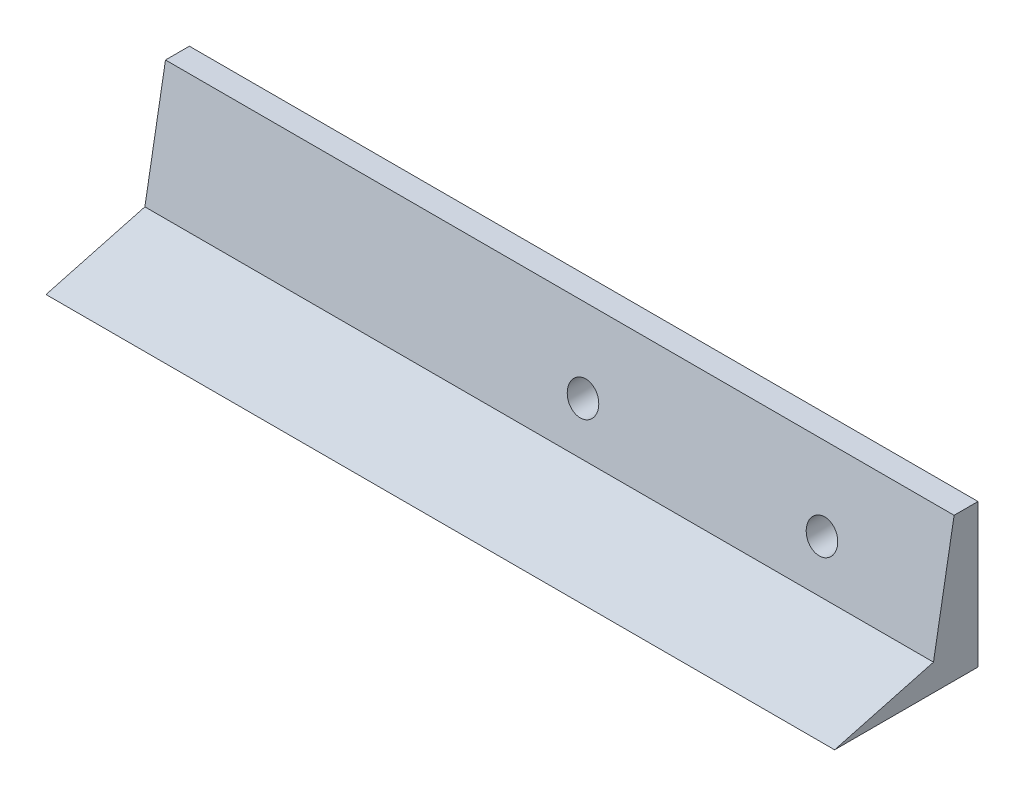
from build123d import *

# Parameters (mm, degrees)
BOSS_EXTRUDE1_DEPTH  = 100
M3_CLEARANCE_HOLE1_D = 3.4
SKETCH4_R            = 3.25
CUT_EXTRUDE1_DEPTH   = 108.964114408
BOSS_EXTRUDE2_DEPTH  = 65


with BuildPart() as part:
    # Sketch1 → Boss-Extrude1 (new body)
    with BuildSketch(Plane(origin=(0, 0, 0), x_dir=(0, 0, -1), z_dir=(1, 0, 0))):
        Polygon((0, 0), (0, 30), (-5, 30), (-9.312388631, 5.54322876), (-30, 0), align=None)
    extrude(amount=BOSS_EXTRUDE1_DEPTH)

    # M3 Clearance Hole1 (through all)
    with Locations(Plane(origin=(0, 0, 0), x_dir=(-1, 0, 0), z_dir=(0, 0, -1))):
        with Locations((-25, 15), (-75, 15)):
            Hole(M3_CLEARANCE_HOLE1_D / 2)

    # Sketch4 → Cut-Extrude1 (cut, through all)
    with BuildSketch(Plane(origin=(0, 0, 2.5), x_dir=(-1, 0, 0), z_dir=(0, 0, -1))):
        with Locations((-75, 15)):
            Circle(SKETCH4_R)
        with Locations((-25, 15)):
            Circle(SKETCH4_R)
    extrude(amount=-CUT_EXTRUDE1_DEPTH, mode=Mode.SUBTRACT)

    # Sketch6 → Boss-Extrude2 (add)
    with BuildSketch(Plane.ZY):
        Polygon((0, 0), (30, 0), (9.312388631, 5.54322876), (5, 30), (0, 30), align=None)
    extrude(amount=BOSS_EXTRUDE2_DEPTH)


solid = part.part
